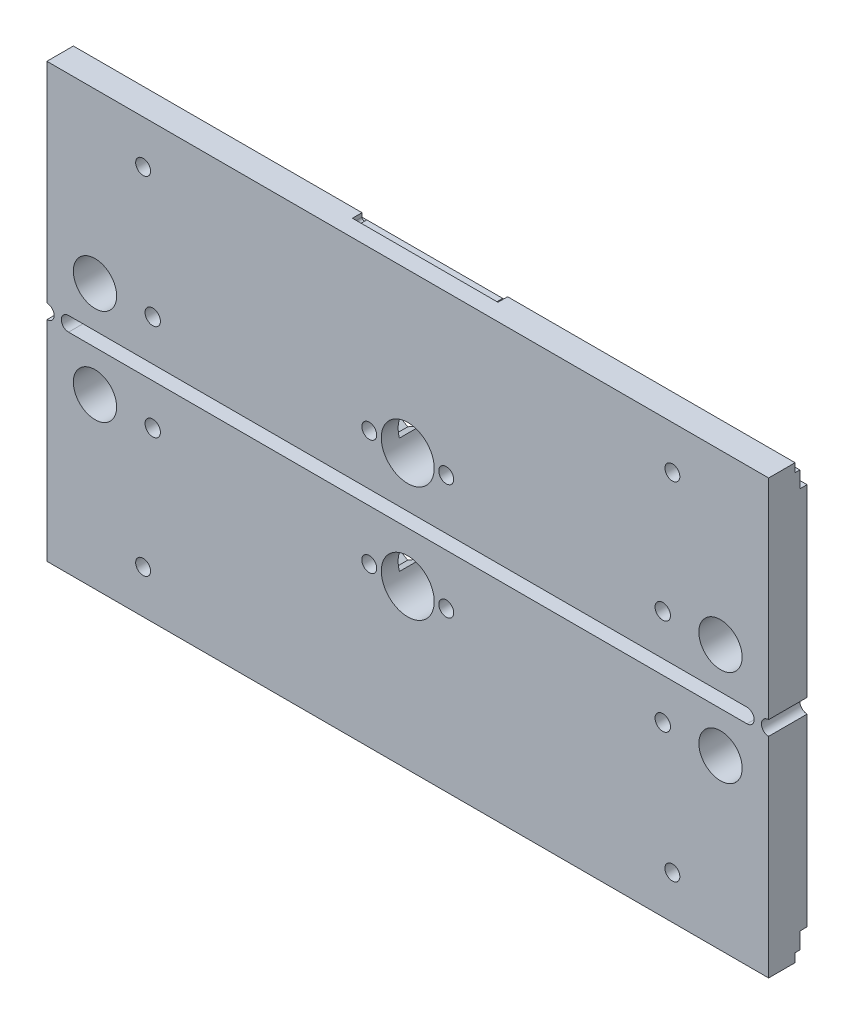
from build123d import *

# Parameters (mm, degrees)
SKETCH_2_W           = 150
SKETCH_2_H           = 43.5
SKETCH_2_R           = 4.5
SKETCH_2_R_2         = 4.05
EXTRUDE_1_DEPTH      = 8
CUT_EXTRUDE_2_DEPTH  = 157.38494173
SKETCH_5_R           = 1.55
CUT_EXTRUDE_3_DEPTH  = 157.38494173
SKETCH_20_R          = 5.5
CUT_EXTRUDE_17_DEPTH = 157.38494173
SKETCH_29_R          = 1.6
CUT_EXTRUDE_18_DEPTH = 157.38494173
CUT_EXTRUDE_5_DEPTH  = 4.5
SKETCH_25_R          = 1.55
CUT_EXTRUDE_13_DEPTH = 157.38494173
CUT_EXTRUDE_11_DEPTH = 2
EXTRUDE_2_DEPTH      = 8


with BuildPart() as part:
    # 草图2 → 凸台-拉伸1 (new body)
    with BuildSketch(Plane.XY):
        with Locations((75, 21.75)):
            Rectangle(SKETCH_2_W, SKETCH_2_H)
        with Locations((10, 8.5)):
            Circle(SKETCH_2_R, mode=Mode.SUBTRACT)
        with Locations((75, 10.5)):
            Circle(SKETCH_2_R_2, mode=Mode.SUBTRACT)
        with Locations((140, 8.5)):
            Circle(SKETCH_2_R, mode=Mode.SUBTRACT)
    extrude_1 = extrude(amount=EXTRUDE_1_DEPTH)

    # 草图4 → 切除-拉伸2 (cut, through all)
    with BuildSketch(Plane(origin=(150, 0, 0), x_dir=(0, 0, -1), z_dir=(1, 0, 0))):
        Polygon((-1.5, 41.7), (-2.5, 41.7), (-2.5, 43.5), (0, 43.5), (0, 38.3), (-1.5, 38.3), align=None)
    cut_extrude_2 = extrude(amount=-CUT_EXTRUDE_2_DEPTH, mode=Mode.SUBTRACT)

    # 草图5 → 切除-拉伸3 (cut, through all)
    with BuildSketch(Plane.XY.offset(8)):
        with Locations((83, 10.5)):
            Circle(SKETCH_5_R)
        with Locations((67, 10.5)):
            Circle(SKETCH_5_R)
    cut_extrude_3 = extrude(amount=-CUT_EXTRUDE_3_DEPTH, mode=Mode.SUBTRACT)

    # 草图20 → 切除-拉伸17 (cut, through all)
    with BuildSketch(Plane(origin=(0, 0, 0), x_dir=(-1, 0, 0), z_dir=(0, 0, -1))):
        with Locations((-75, 10.5)):
            Circle(SKETCH_20_R)
    cut_extrude_17 = extrude(amount=-CUT_EXTRUDE_17_DEPTH, mode=Mode.SUBTRACT)

    # 草图29 → 切除-拉伸18 (cut, through all)
    with BuildSketch(Plane.XY.offset(8)):
        with Locations((22, 8.5)):
            Circle(SKETCH_29_R)
        with Locations(Location((128, 8.5, 0), (0, 0, 180))):
            Circle(SKETCH_29_R)
    cut_extrude_18 = extrude(amount=-CUT_EXTRUDE_18_DEPTH, mode=Mode.SUBTRACT)

    # 草图8 → 切除-拉伸5 (cut)
    with BuildSketch(Plane(origin=(0, 0, 0), x_dir=(-1, 0, 0), z_dir=(0, 0, -1))):
        Polygon((-80.15, 8.854551733), (-80.15, 12.145448267), (-83, 13.790896534), (-85.85, 12.145448267), (-85.85, 8.854551733), (-83, 7.209103466), align=None)
        Polygon((-64.15, 8.854551733), (-64.15, 12.145448267), (-67, 13.790896534), (-69.85, 12.145448267), (-69.85, 8.854551733), (-67, 7.209103466), align=None)
        Polygon((-22, 5.209103466), (-19.15, 6.854551733), (-19.15, 10.145448267), (-22, 11.790896534), (-24.85, 10.145448267), (-24.85, 6.854551733), align=None)
        Polygon((-125.15, 6.854551733), (-125.15, 10.145448267), (-128, 11.790896534), (-130.85, 10.145448267), (-130.85, 6.854551733), (-128, 5.209103466), align=None)
    cut_extrude_5 = extrude(amount=-CUT_EXTRUDE_5_DEPTH, mode=Mode.SUBTRACT)

    # 草图25 → 切除-拉伸13 (cut, through all)
    with BuildSketch(Plane(origin=(0, 0, 0), x_dir=(-1, 0, 0), z_dir=(0, 0, -1))):
        with Locations((-130, 34.5)):
            Circle(SKETCH_25_R)
        with Locations((-20, 34.5)):
            Circle(SKETCH_25_R)
    cut_extrude_13 = extrude(amount=-CUT_EXTRUDE_13_DEPTH, mode=Mode.SUBTRACT)

    # 草图19 → 切除-拉伸11 (cut)
    with BuildSketch(Plane(origin=(0, 0, 2.5), x_dir=(-1, 0, 0), z_dir=(0, 0, -1))):
        with BuildLine():
            Line((-60, 43.5), (-90.247938178, 43.5))
            Line((-90.247938178, 43.5), (-90.247938178, 42.7))
            ThreePointArc((-90.247938178, 42.7), (-89.747938178, 42.2), (-89.247938178, 42.7))
            Line((-89.247938178, 42.7), (-61, 42.7))
            ThreePointArc((-61, 42.7), (-60.5, 42.2), (-60, 42.7))
            Line((-60, 42.7), (-60, 43.5))
        make_face()
    cut_extrude_11 = extrude(amount=-CUT_EXTRUDE_11_DEPTH, mode=Mode.SUBTRACT)

    # 草图22 → 凸台-拉伸2 (add)
    with BuildSketch(Plane.XY.offset(8)):
        with BuildLine():
            Line((0, -3), (4.5, -3))
            ThreePointArc((4.5, -3), (3, -1.5), (4.5, 0))
            Line((4.5, 0), (0, 0))
            ThreePointArc((0, 0), (1.5, -1.5), (0, -3))
        make_face()
        with BuildLine():
            Line((150, 0), (145.5, 0))
            ThreePointArc((145.5, 0), (147, -1.5), (145.5, -3))
            Line((145.5, -3), (150, -3))
            ThreePointArc((150, -3), (148.5, -1.5), (150, 0))
        make_face()
    extrude(amount=-EXTRUDE_2_DEPTH)

    # 镜向2: 凸台-拉伸1, 切除-拉伸2, 切除-拉伸3, 切除-拉伸17, 切除-拉伸18, 切除-拉伸5, 切除-拉伸13, 切除-拉伸11 across plane
    add(extrude_1.mirror(Plane(origin=(0, -1.5, 0), x_dir=(0, 0, 1), z_dir=(0, -1, 0))))
    add(cut_extrude_2.mirror(Plane(origin=(0, -1.5, 0), x_dir=(0, 0, 1), z_dir=(0, -1, 0))), mode=Mode.SUBTRACT)
    add(cut_extrude_3.mirror(Plane(origin=(0, -1.5, 0), x_dir=(0, 0, 1), z_dir=(0, -1, 0))), mode=Mode.SUBTRACT)
    add(cut_extrude_17.mirror(Plane(origin=(0, -1.5, 0), x_dir=(0, 0, 1), z_dir=(0, -1, 0))), mode=Mode.SUBTRACT)
    add(cut_extrude_18.mirror(Plane(origin=(0, -1.5, 0), x_dir=(0, 0, 1), z_dir=(0, -1, 0))), mode=Mode.SUBTRACT)
    add(cut_extrude_5.mirror(Plane(origin=(0, -1.5, 0), x_dir=(0, 0, 1), z_dir=(0, -1, 0))), mode=Mode.SUBTRACT)
    add(cut_extrude_13.mirror(Plane(origin=(0, -1.5, 0), x_dir=(0, 0, 1), z_dir=(0, -1, 0))), mode=Mode.SUBTRACT)
    add(cut_extrude_11.mirror(Plane(origin=(0, -1.5, 0), x_dir=(0, 0, 1), z_dir=(0, -1, 0))), mode=Mode.SUBTRACT)


solid = part.part
